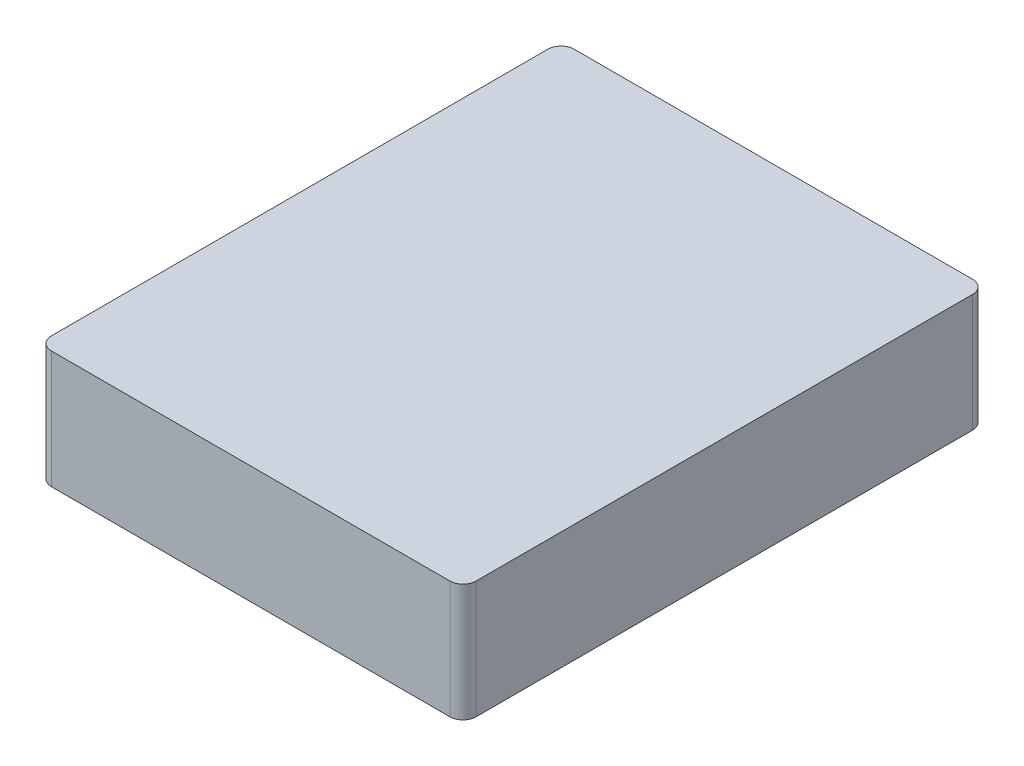
from build123d import *

# Parameters (mm, degrees)
SKETCH1_W           = 65
SKETCH1_H           = 80
BOSS_EXTRUDE1_DEPTH = 18
FILLET1_R           = 2


with BuildPart() as part:
    # Sketch1 → Boss-Extrude1 (new body)
    with BuildSketch(Plane(origin=(0, 0, 0), x_dir=(1, 0, 0), z_dir=(0, 1, 0))):
        Rectangle(SKETCH1_W, SKETCH1_H)
    extrude(amount=BOSS_EXTRUDE1_DEPTH)

    # Fillet1
    fillet1_edges = [part.edges().sort_by_distance(p)[0] for p in [
        (32.5, 9, 40),
        (-32.5, 9, 40),
        (-32.5, 9, -40),
        (32.5, 9, -40),
    ]]
    fillet(fillet1_edges, radius=FILLET1_R)


solid = part.part
